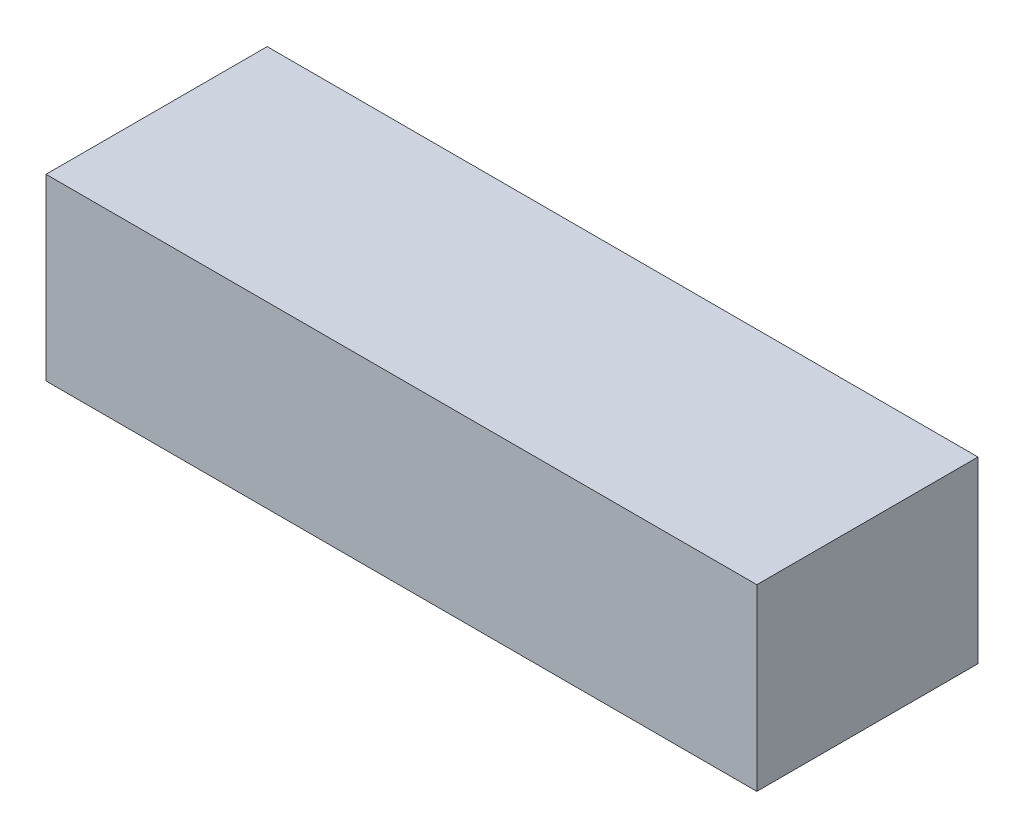
from build123d import *

# Parameters (mm, degrees)
SKETCH1_W           = 135
SKETCH1_H           = 42
BOSS_EXTRUDE1_DEPTH = 34


with BuildPart() as part:
    # Sketch1 → Boss-Extrude1 (new body)
    with BuildSketch(Plane(origin=(0, 0, 0), x_dir=(1, 0, 0), z_dir=(0, 1, 0))):
        Rectangle(SKETCH1_W, SKETCH1_H)
    extrude(amount=BOSS_EXTRUDE1_DEPTH)


solid = part.part
